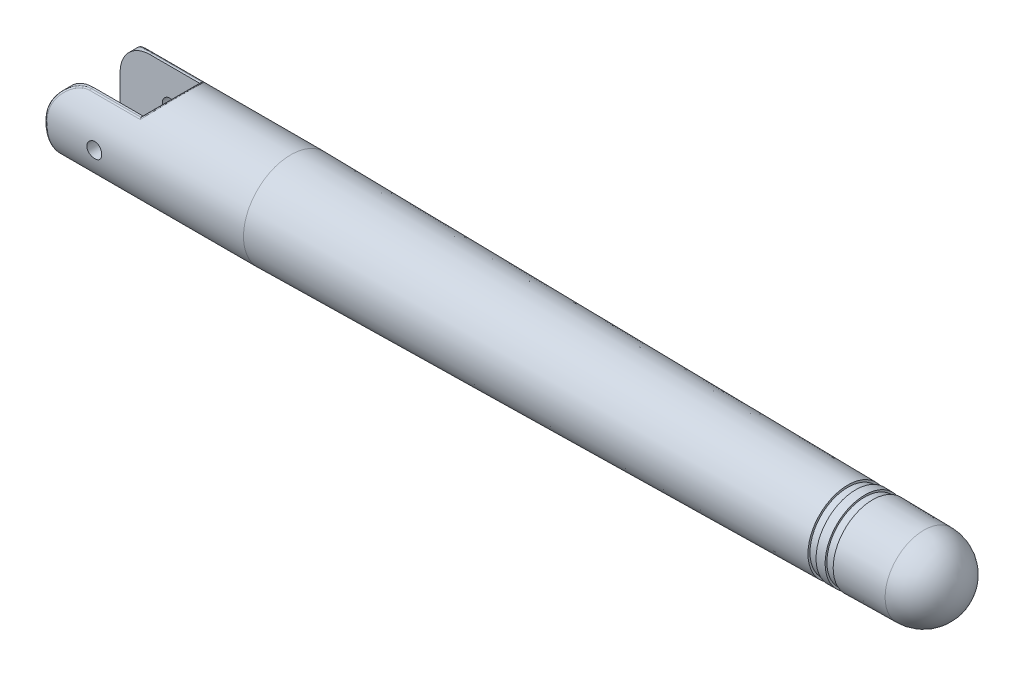
from build123d import *

# Parameters (mm, degrees)
CUT_EXTRUDE_1_DEPTH      = 88.757478314
CUT_EXTRUDE_1_DEPTH_BACK = 3.5
SKETCH_2_W               = 8
SKETCH_2_H               = 5.7
CUT_EXTRUDE_2_DEPTH      = 88.757478314
CUT_EXTRUDE_2_DEPTH_BACK = 88.757478314
SKETCH_3_R               = 0.75
FILLET_2_R               = 3
FILLET_1_R               = 0.25


with BuildPart() as part:
    # Эскиз1 → Повернуть1 (revolve)
    with BuildSketch(Plane.XY, mode=Mode.PRIVATE) as revolve_1_sk:
        with BuildLine():
            Line((0, 0), (0, 4.75))
            Line((0, 4.75), (20, 4.75))
            Line((20, 4.75), (76, 4.001878745))
            Line((76, 4.001878745), (76, 3.8))
            Line((76, 3.8), (76.8, 3.8))
            Line((76.8, 3.8), (76.8, 3.991191298))
            Line((76.8, 3.991191298), (77.7, 3.979167921))
            Line((77.7, 3.979167921), (77.7, 3.8))
            Line((77.7, 3.8), (78.5, 3.8))
            Line((78.5, 3.8), (78.5, 3.968480475))
            Line((78.5, 3.968480475), (83.652096653, 3.899652028))
            ThreePointArc((83.652096653, 3.899652028), (86.376074292, 2.739235573), (87.5, 0))
            Line((87.5, 0), (0, 0))
        make_face()
    revolve(revolve_1_sk.sketch.rotate(Axis((0, 0, 0), (1, 0, 0)), 90), axis=Axis((0, 0, 0), (1, 0, 0)))

    # Эскиз2 → Вырез-Вытянуть1 (cut, two sides: drawn at the far end of the back side and taken through both)
    with BuildSketch(Plane(origin=(0, 0, 0), x_dir=(1, 0, 0), z_dir=(0, 1, 0)).offset(-CUT_EXTRUDE_1_DEPTH_BACK)):
        with Locations((4, 0)):
            Rectangle(SKETCH_2_W, SKETCH_2_H)
    extrude(amount=CUT_EXTRUDE_1_DEPTH + CUT_EXTRUDE_1_DEPTH_BACK, mode=Mode.SUBTRACT)

    # Эскиз3 → Вырез-Вытянуть2 (cut, two sides: drawn at the far end of the back side and taken through both)
    with BuildSketch(Plane.XY.offset(-CUT_EXTRUDE_2_DEPTH_BACK)):
        with Locations((5, 0)):
            Circle(SKETCH_3_R)
        Polygon((0, 3.8), (0, 3.55), (8, 3.55), (9.2, 4.75), (0, 4.75), align=None)
    extrude(amount=CUT_EXTRUDE_2_DEPTH + CUT_EXTRUDE_2_DEPTH_BACK, mode=Mode.SUBTRACT)

    # Скругление2
    fillet_2_edges = [part.edges().sort_by_distance(p)[0] for p in [
        (0, 3.55, -3.002973384),
        (0, 3.55, 3.002973384),
    ]]
    fillet(fillet_2_edges, radius=FILLET_2_R)

    # Скругление1
    fillet_1_edges = [part.edges().sort_by_distance(p)[0] for p in [
        (8.858337234, 4.408337234, 1.768915722),
        (5.5, 3.55, 3.155946768),
        (5.5, 3.55, -3.155946768),
        (0, -4.742005884, -0.275463597),
        (0.880063584, 2.672703362, 3.926723407),
        (0.880063584, 2.672703362, -3.926723407),
    ]]
    fillet(fillet_1_edges, radius=FILLET_1_R)


solid = part.part
